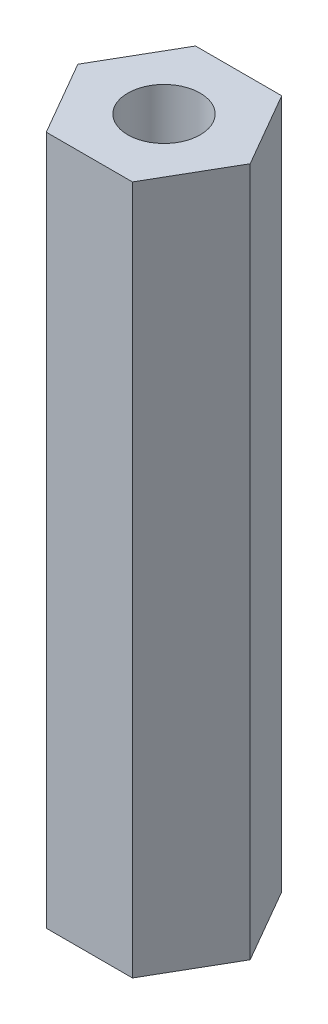
from build123d import *

# Parameters (mm, degrees)
SKETCH1_R                = 2.1
BOSS_EXTRUDE1_DEPTH      = 40
BOSS_EXTRUDE3_DEPTH      = 14
BOSS_EXTRUDE3_DEPTH_BACK = 14
SKETCH2_R                = 2.1


with BuildPart() as part:
    # Sketch1 → Boss-Extrude1 (new body)
    with BuildSketch(Plane(origin=(0, 0, 0), x_dir=(1, 0, 0), z_dir=(0, 1, 0))):
        Polygon((5, 0), (2.5, 4.330127019), (-2.5, 4.330127019), (-5, 0), (-2.5, -4.330127019), (2.5, -4.330127019), align=None)
        with Locations(Location((0, 0, 0), (0, 0, 270))):
            Circle(SKETCH1_R, mode=Mode.SUBTRACT)
    extrude(amount=BOSS_EXTRUDE1_DEPTH)

    # Sketch2 → Boss-Extrude3 (add, two sides: drawn at the far end of the back side and taken through both)
    with BuildSketch(Plane(origin=(0, 20, 0), x_dir=(1, 0, 0), z_dir=(0, 1, 0)).offset(-BOSS_EXTRUDE3_DEPTH_BACK)):
        with Locations(Location((0, 0, 0), (0, 0, 270))):
            Circle(SKETCH2_R)
    extrude(amount=BOSS_EXTRUDE3_DEPTH + BOSS_EXTRUDE3_DEPTH_BACK)


solid = part.part
